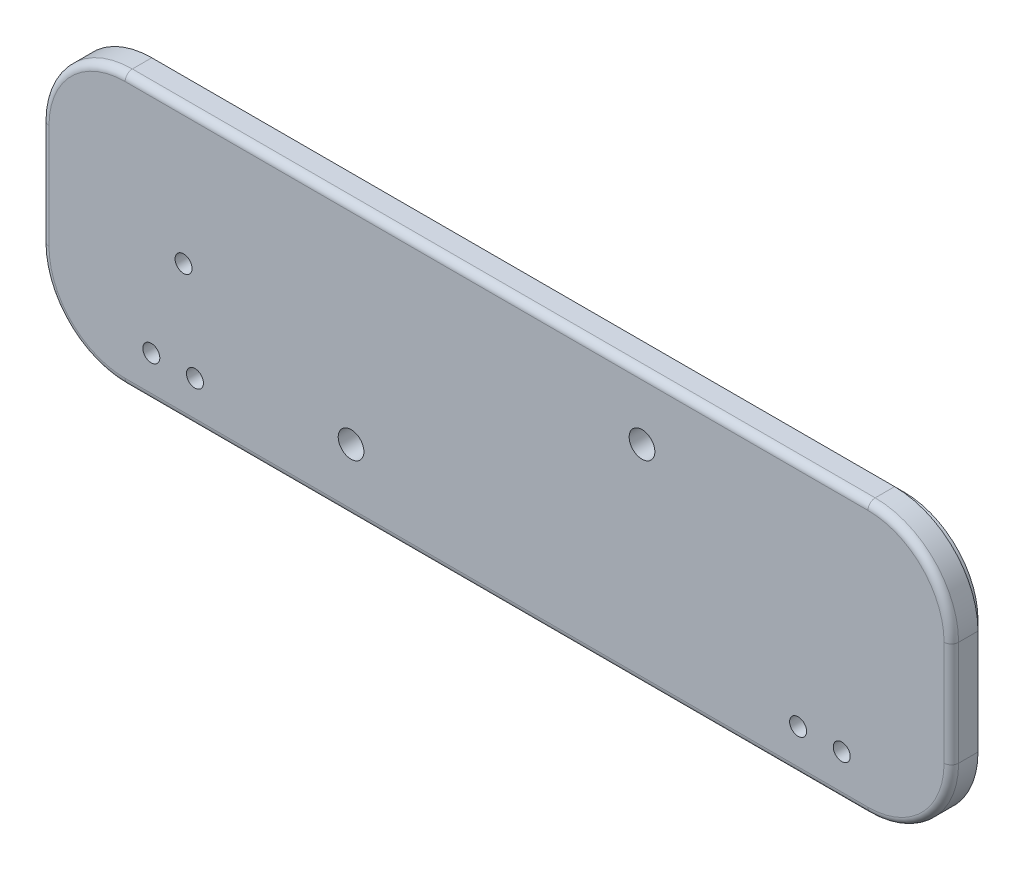
from build123d import *

# Parameters (mm, degrees)
SKETCH1_W           = 47.6504
SKETCH1_H           = 14.224
BOSS_EXTRUDE1_DEPTH = 1.397
SKETCH2_W           = 46.6344
SKETCH2_H           = 13.208
BOSS_EXTRUDE2_DEPTH = 0.508
FILLET1_R           = 3.8608
FILLET2_R           = 3.8608
FILLET3_R           = 3.8608
FILLET4_R           = 3.8608
FILLET5_R           = 4.3688
FILLET6_R           = 4.3688
FILLET7_R           = 4.3688
FILLET8_R           = 4.3688
FILLET9_R           = 0.381
LPATTERN1_COUNT     = 2
LPATTERN1_PITCH     = 2.286
SKETCH7_R           = 0.6731
CUT_EXTRUDE1_DEPTH  = 25.936914886
SKETCH8_R           = 0.17145
CUT_EXTRUDE2_DEPTH  = 1.27


with BuildPart() as part:
    # Sketch1 → Boss-Extrude1 (new body)
    with BuildSketch(Plane(origin=(0, 0, -1.397), x_dir=(-1, 0, 0), z_dir=(0, 0, -1))):
        Rectangle(SKETCH1_W, SKETCH1_H)
    extrude(amount=-BOSS_EXTRUDE1_DEPTH)

    # Sketch2 → Boss-Extrude2 (add)
    with BuildSketch(Plane(origin=(0, 0, -1.397), x_dir=(-1, 0, 0), z_dir=(0, 0, -1))):
        Rectangle(SKETCH2_W, SKETCH2_H)
    extrude(amount=BOSS_EXTRUDE2_DEPTH)

    # Sketch3 → Cut-Revolve1 (revolve, cut)
    with BuildSketch(Plane.XZ, mode=Mode.PRIVATE) as cut_revolve1_sk:
        Polygon((-15.9512, 0), (-16.3957, 0), (-16.3957, -1.905), (-16.0147, -1.905), (-16.0147, -1.651), (-15.9512, -1.651), align=None)
    revolve(cut_revolve1_sk.sketch.rotate(Axis((-16.3957, 0, 0), (0, 0, -1)), 180), axis=Axis((-16.3957, 0, 0), (0, 0, -1)), mode=Mode.SUBTRACT)

    # Sketch6 → Cut-Revolve4 (revolve, cut)
    with BuildSketch(Plane.XZ.offset(4.9022), mode=Mode.PRIVATE) as cut_revolve4_sk:
        Polygon((-15.3543, 0), (-15.7988, 0), (-15.7988, -1.905), (-15.4178, -1.905), (-15.4178, -1.778), (-15.3543, -1.778), align=None)
    cut_revolve4 = revolve(cut_revolve4_sk.sketch.rotate(Axis((-15.7988, -4.9022, 0), (0, 0, -1)), 180), axis=Axis((-15.7988, -4.9022, 0), (0, 0, -1)), mode=Mode.SUBTRACT)

    # Fillet1
    fillet1_edges = [part.edges().sort_by_distance(p)[0] for p in [
        (23.3172, -6.604, -1.651),
    ]]
    fillet(fillet1_edges, radius=FILLET1_R)

    # Fillet2
    fillet2_edges = [part.edges().sort_by_distance(p)[0] for p in [
        (-23.3172, -6.604, -1.651),
    ]]
    fillet(fillet2_edges, radius=FILLET2_R)

    # Fillet3
    fillet3_edges = [part.edges().sort_by_distance(p)[0] for p in [
        (-23.3172, 6.604, -1.651),
    ]]
    fillet(fillet3_edges, radius=FILLET3_R)

    # Fillet4
    fillet4_edges = [part.edges().sort_by_distance(p)[0] for p in [
        (23.3172, 6.604, -1.651),
    ]]
    fillet(fillet4_edges, radius=FILLET4_R)

    # Fillet5
    fillet5_edges = [part.edges().sort_by_distance(p)[0] for p in [
        (-23.8252, -7.112, -0.6985),
    ]]
    fillet(fillet5_edges, radius=FILLET5_R)

    # Fillet6
    fillet6_edges = [part.edges().sort_by_distance(p)[0] for p in [
        (-23.8252, 7.112, -0.6985),
    ]]
    fillet(fillet6_edges, radius=FILLET6_R)

    # Fillet7
    fillet7_edges = [part.edges().sort_by_distance(p)[0] for p in [
        (23.8252, 7.112, -0.6985),
    ]]
    fillet(fillet7_edges, radius=FILLET7_R)

    # Fillet8
    fillet8_edges = [part.edges().sort_by_distance(p)[0] for p in [
        (23.8252, -7.112, -0.6985),
    ]]
    fillet(fillet8_edges, radius=FILLET8_R)

    # Fillet9
    fillet9_edges = [part.edges().sort_by_distance(p)[0] for p in [
        (-23.8252, 0, 0),
        (-22.545608106, -5.832408106, 0),
        (0, 7.112, 0),
        (-22.545608106, 5.832408106, 0),
        (23.8252, 0, 0),
        (22.545608106, 5.832408106, 0),
        (0, -7.112, 0),
        (22.545608106, -5.832408106, 0),
    ]]
    fillet(fillet9_edges, radius=FILLET9_R)

    # LPattern1: Cut-Revolve4 ×2
    with Locations(*[(-i * LPATTERN1_PITCH, 0, 0) for i in range(1, LPATTERN1_COUNT)]):
        add(cut_revolve4, mode=Mode.SUBTRACT)

    # Mirror1: Cut-Revolve4 across plane
    add(cut_revolve4.mirror(Plane(origin=(0, 0, 0), x_dir=(0, 0, 1), z_dir=(1, 0, 0))), mode=Mode.SUBTRACT)

    # Mirror1 copy 1 sketch → Mirror1 copy 1 (revolve, cut)
    with BuildSketch(Plane(origin=(2.286, -4.9022, 0), x_dir=(-1, 0, 0), z_dir=(0, -1, 0))):
        Polygon((-15.3543, 0), (-15.7988, 0), (-15.7988, 1.905), (-15.4178, 1.905), (-15.4178, 1.778), (-15.3543, 1.778), align=None)
    revolve(axis=Axis((18.0848, -4.9022, 0), (0, 0, 1)), mode=Mode.SUBTRACT)

    # Sketch7 → Cut-Extrude1 (cut, through all)
    with BuildSketch(Plane.XY):
        with Locations((-7.62, -3.81)):
            Circle(SKETCH7_R)
        with Locations((7.62, 3.81)):
            Circle(SKETCH7_R)
    extrude(amount=-CUT_EXTRUDE1_DEPTH, mode=Mode.SUBTRACT)

    # Sketch8 → Cut-Extrude2 (cut)
    with BuildSketch(Plane(origin=(0, 0, -1.905), x_dir=(-1, 0, 0), z_dir=(0, 0, -1))):
        with Locations((0, -4.9022)):
            Circle(SKETCH8_R)
    extrude(amount=-CUT_EXTRUDE2_DEPTH, mode=Mode.SUBTRACT)


solid = part.part
